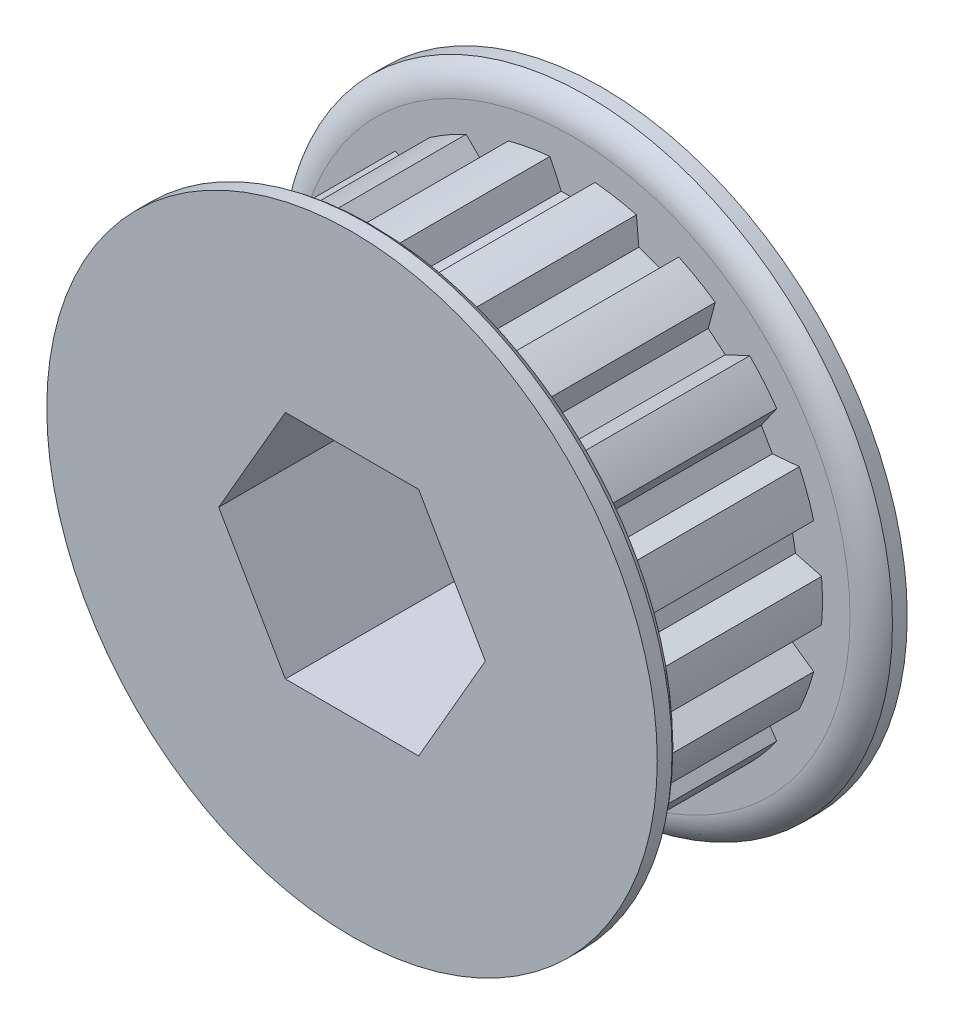
from build123d import *

# Parameters (mm, degrees)
CUT_EXTRUDE1_START = 2.2987
CUT_EXTRUDE1_DEPTH = 10.922
CIRPATTERN1_COUNT  = 18
SKETCH4_R          = 2.0828
CUT_EXTRUDE2_DEPTH = 27.762350537
CUT_EXTRUDE3_DEPTH = 1.5621
CIRPATTERN2_COUNT  = 2
CIRPATTERN2_ANGLE  = 90
CUT_EXTRUDE4_DEPTH = 33.175459463
SKETCH8_R          = 13.842582523
CUT_EXTRUDE5_DEPTH = 29.537230639


with BuildPart() as part:
    # Sketch2 → Revolve1 (revolve)
    with BuildSketch(Plane(origin=(0, 0, 0), x_dir=(0, 0, -1), z_dir=(1, 0, 0)), mode=Mode.PRIVATE) as revolve1_sk:
        with BuildLine():
            Line((-10.3124, 4.7625), (10.3124, 4.7625))
            Line((10.3124, 4.7625), (10.3124, 17.4625))
            Line((10.3124, 17.4625), (9.46785, 17.4625))
            ThreePointArc((9.46785, 17.4625), (8.847668679, 16.777633999), (8.6233, 15.88135))
            Line((8.6233, 15.88135), (8.6233, 14.3002))
            Line((8.6233, 14.3002), (-2.2987, 14.3002))
            Line((-2.2987, 14.3002), (-2.2987, 15.88135))
            ThreePointArc((-2.2987, 15.88135), (-2.523068679, 16.777633999), (-3.14325, 17.4625))
            Line((-3.14325, 17.4625), (-3.9878, 17.4625))
            Line((-3.9878, 17.4625), (-3.9878, 10.3124))
            Line((-3.9878, 10.3124), (-10.3124, 10.3124))
            Line((-10.3124, 10.3124), (-10.3124, 4.7625))
        make_face()
    revolve(revolve1_sk.sketch.rotate(Axis((0, 0, 10.3124), (0, 0, -1)), 90), axis=Axis((0, 0, 10.3124), (0, 0, -1)))

    # Sketch3 → Cut-Extrude1 (cut)
    with BuildSketch(Plane.XY.offset(CUT_EXTRUDE1_START)):
        with BuildLine():
            Line((-0.635, 12.842092967), (0.635, 12.842092967))
            Line((0.635, 12.842092967), (1.287830721, 14.242092967))
            ThreePointArc((1.287830721, 14.242092967), (0, 14.3002), (-1.287830721, 14.242092967))
            Line((-1.287830721, 14.242092967), (-0.635, 12.842092967))
        make_face()
    cut_extrude1 = extrude(amount=-CUT_EXTRUDE1_DEPTH, mode=Mode.SUBTRACT)

    # CirPattern1: Cut-Extrude1 ×18 about axis
    cirpattern1_axis = Axis((0, 0, 0), (0, 0, 1))
    for i in range(1, CIRPATTERN1_COUNT):
        add(cut_extrude1.rotate(cirpattern1_axis, i * 360 / CIRPATTERN1_COUNT), mode=Mode.SUBTRACT)

    # Sketch4 → Cut-Extrude2 (cut, through all)
    with BuildSketch(Plane(origin=(0, 0, 0), x_dir=(1, 0, 0), z_dir=(0, 1, 0))):
        with Locations(Location((0, -7.1501, 0), (0, 0, 90))):
            Circle(SKETCH4_R)
    cut_extrude2 = extrude(amount=CUT_EXTRUDE2_DEPTH, mode=Mode.SUBTRACT)

    # Sketch5 → Revolve2 (revolve)
    with BuildSketch(Plane.XY.offset(7.1501), mode=Mode.PRIVATE) as revolve2_sk:
        Polygon((1.5748, 10.099878114), (2.0828, 9.591878114), (2.0828, 5.3975), (1.4478, 4.7625), (0, 4.7625), (0, 10.099878114), align=None)
    revolve2 = revolve(revolve2_sk.sketch.rotate(Axis((0, 0, 7.1501), (0, 1, 0)), 90), axis=Axis((0, 0, 7.1501), (0, 1, 0)))

    # Sketch6 → Cut-Extrude3 (cut)
    with BuildSketch(Plane(origin=(0, 10.099878114, 0), x_dir=(1, 0, 0), z_dir=(0, 1, 0))):
        Polygon((0, -5.947594859), (-1.0414, -6.54884743), (-1.0414, -7.75135257), (0, -8.352605141), (1.0414, -7.75135257), (1.0414, -6.54884743), align=None)
    cut_extrude3 = extrude(amount=-CUT_EXTRUDE3_DEPTH, mode=Mode.SUBTRACT)

    # CirPattern2: Cut-Extrude2, Revolve2, Cut-Extrude3 ×2 about axis
    cirpattern2_axis = Axis((0, 0, 0), (0, 0, -1))
    add([cut_extrude2.rotate(cirpattern2_axis, i * CIRPATTERN2_ANGLE / (CIRPATTERN2_COUNT - 1)) for i in range(1, CIRPATTERN2_COUNT)], mode=Mode.SUBTRACT)
    add([revolve2.rotate(cirpattern2_axis, i * CIRPATTERN2_ANGLE / (CIRPATTERN2_COUNT - 1)) for i in range(1, CIRPATTERN2_COUNT)])
    add([cut_extrude3.rotate(cirpattern2_axis, i * CIRPATTERN2_ANGLE / (CIRPATTERN2_COUNT - 1)) for i in range(1, CIRPATTERN2_COUNT)], mode=Mode.SUBTRACT)

    # Sketch7 → Cut-Extrude4 (cut, through all)
    with BuildSketch(Plane(origin=(0, 0, -10.3124), x_dir=(-1, 0, 0), z_dir=(0, 0, -1))):
        Polygon((3.812821178, -6.604), (7.625642355, 0), (3.812821178, 6.604), (-3.812821178, 6.604), (-7.625642355, 0), (-3.812821178, -6.604), align=None)
    extrude(amount=-CUT_EXTRUDE4_DEPTH, mode=Mode.SUBTRACT)

    # Sketch8 → Cut-Extrude5 (cut, through all)
    with BuildSketch(Plane.XY.offset(3.9878)):
        Circle(SKETCH8_R)
    extrude(amount=CUT_EXTRUDE5_DEPTH, mode=Mode.SUBTRACT)


solid = part.part
